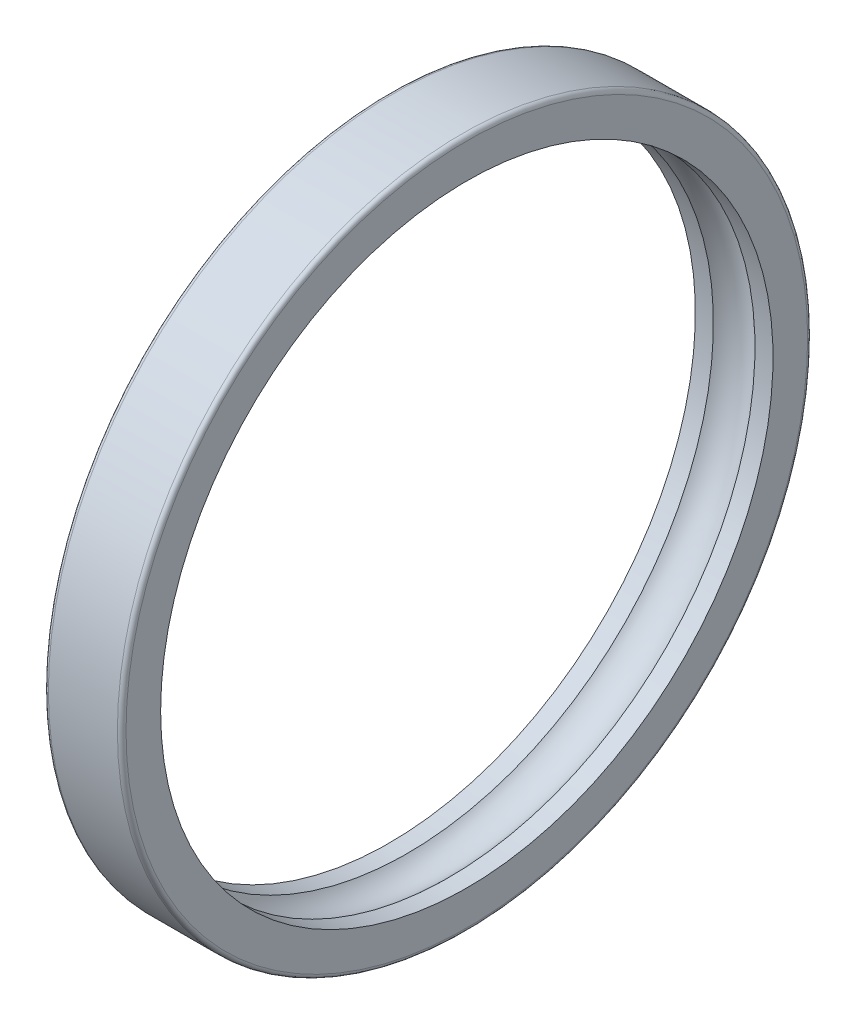
from build123d import *


with BuildPart() as part:
    # Schizzo1 → Rivoluzione1 (revolve)
    with BuildSketch(Plane.XY, mode=Mode.PRIVATE) as rivoluzione1_sk:
        with BuildLine():
            Line((0, 79), (0, 70.975))
            Line((0, 70.975), (4.183737549, 70.975))
            ThreePointArc((4.183737549, 70.975), (9, 72.997), (13.816262451, 70.975))
            Line((13.816262451, 70.975), (18, 70.975))
            Line((18, 70.975), (18, 79))
            ThreePointArc((18, 79), (17.707106781, 79.707106781), (17, 80))
            Line((17, 80), (1, 80))
            ThreePointArc((1, 80), (0.292893219, 79.707106781), (0, 79))
        make_face()
    revolve(rivoluzione1_sk.sketch.rotate(Axis((200, 0, 0), (-1, 0, 0)), 270), axis=Axis((200, 0, 0), (-1, 0, 0)))


solid = part.part
